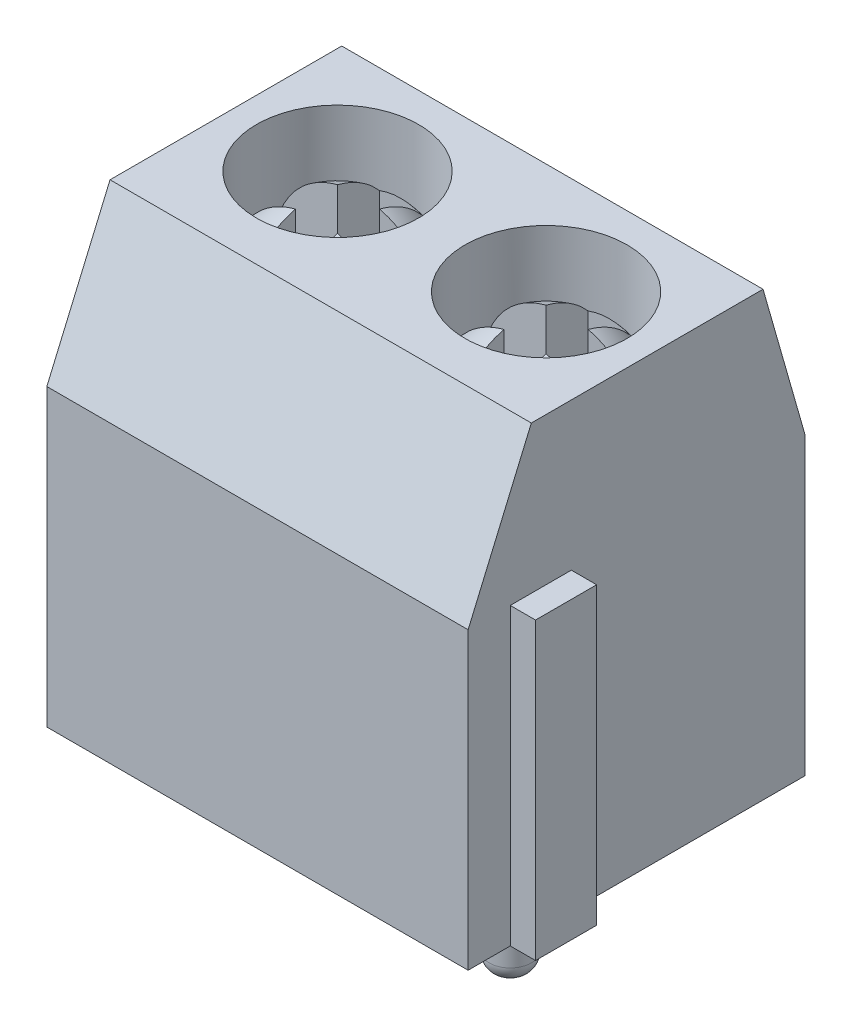
from build123d import *

# Parameters (mm, degrees)
BODY_DEPTH                   = 10
TERMINAL_CUT_OUT_SKETCH_W    = 4
TERMINAL_CUT_OUT_SKETCH_H    = 5
TERMINAL_CUT_OUT_DEPTH       = 2
SKETCH3_W                    = 1
SKETCH3_H                    = 1
CUT_EXTRUDE2_DEPTH           = 5
SKETCH4_R                    = 1.5
CUT_EXTRUDE3_DEPTH           = 5
BOSS_EXTRUDE2_DEPTH          = 0.1
PINS_SKETCH_R                = 0.499
PINS_DEPTH                   = 4
PIN_ENDS_FILLETS_R           = 0.4
LINK_CUT_SKETCH_W            = 1.3
LINK_CUT_SKETCH_H            = 7
LINK_CUT_EXTRUDE_DEPTH       = 0.6
LINK_BOSS_SKETCH_W           = 1.45
LINK_BOSS_SKETCH_H           = 7
LINK_BOSS_EXTRUDE_DEPTH      = 0.6
SCREW_HOLE_SKETCH_R          = 1.925
SCREW_HOLE_CUT_DEPTH         = 2
SKETCH11_W                   = 2
SKETCH11_H                   = 0.1
BOSS_EXTRUDE7_DEPTH          = 3
FILLET1_R                    = 0.1
SKETCH15_W                   = 1
SKETCH15_H                   = 1
CUT_EXTRUDE6_DEPTH           = 3
CUT_EXTRUDE8_DEPTH           = 1
CUT_EXTRUDE8_DRAFT           = -20
CUT_EXTRUDE8_PROFILE_2_DEPTH = 1
CUT_EXTRUDE8_PROFILE_2_DRAFT = -20


with BuildPart() as part:
    # Body Sketch → Body (new body)
    with BuildSketch(Plane(origin=(0, 0, 0), x_dir=(0, 0, -1), z_dir=(1, 0, 0))):
        Polygon((0, 0), (0, 7), (1.5, 10.5), (7, 10.5), (8, 7), (8, 0), align=None)
    extrude(amount=BODY_DEPTH)

    # Terminal Cut Out Sketch → Terminal Cut Out (cut)
    with BuildSketch(Plane(origin=(0, 0, -8), x_dir=(-1, 0, 0), z_dir=(0, 0, -1))):
        with Locations((-7.5, 3.5)):
            Rectangle(TERMINAL_CUT_OUT_SKETCH_W, TERMINAL_CUT_OUT_SKETCH_H)
        with Locations((-2.5, 3.5)):
            Rectangle(TERMINAL_CUT_OUT_SKETCH_W, TERMINAL_CUT_OUT_SKETCH_H)
    extrude(amount=-TERMINAL_CUT_OUT_DEPTH, mode=Mode.SUBTRACT)

    # Sketch3 → Cut-Extrude2 (cut)
    with BuildSketch(Plane(origin=(0, 0, -8), x_dir=(-1, 0, 0), z_dir=(0, 0, -1))):
        with Locations((-7.5, 0.5)):
            Rectangle(SKETCH3_W, SKETCH3_H)
        with Locations((-2.5, 0.5)):
            Rectangle(SKETCH3_W, SKETCH3_H)
    extrude(amount=-CUT_EXTRUDE2_DEPTH, mode=Mode.SUBTRACT)

    # Sketch4 → Cut-Extrude3 (cut)
    with BuildSketch(Plane(origin=(0, 0, -6), x_dir=(-1, 0, 0), z_dir=(0, 0, -1))):
        with Locations(Location((-7.5, 3.5, 0), (0, 0, 90))):
            Circle(SKETCH4_R)
        with Locations(Location((-2.5, 3.5, 0), (0, 0, 90))):
            Circle(SKETCH4_R)
    extrude(amount=-CUT_EXTRUDE3_DEPTH, mode=Mode.SUBTRACT)

    # Sketch6 → Boss-Extrude2 (add)
    with BuildSketch(Plane(origin=(0, 0, -6), x_dir=(-1, 0, 0), z_dir=(0, 0, -1))):
        Polygon((-9.5, 6), (-8.5, 3), (-6.5, 3), (-5.5, 6), align=None)
        Polygon((-4.5, 6), (-0.5, 6), (-1.5, 3), (-3.5, 3), align=None)
    extrude(amount=BOSS_EXTRUDE2_DEPTH)

    # Pins Sketch → Pins (add)
    with BuildSketch(Plane.XZ.offset(-1)):
        with Locations(Location((2.5, -3.5, 0), (0, 0, 90))):
            Circle(PINS_SKETCH_R)
        with Locations(Location((7.5, -3.5, 0), (0, 0, 90))):
            Circle(PINS_SKETCH_R)
    extrude(amount=PINS_DEPTH)

    # Pin Ends Fillets
    pin_ends_fillets_edges = [part.edges().sort_by_distance(p)[0] for p in [
        (2.5, -3, -3.999),
        (7.5, -3, -3.999),
    ]]
    fillet(pin_ends_fillets_edges, radius=PIN_ENDS_FILLETS_R)

    # Link Cut Sketch → Link Cut Extrude (cut)
    with BuildSketch(Plane.ZY):
        with Locations((-1.65, 3.5)):
            Rectangle(LINK_CUT_SKETCH_W, LINK_CUT_SKETCH_H)
    extrude(amount=-LINK_CUT_EXTRUDE_DEPTH, mode=Mode.SUBTRACT)

    # Link Boss Sketch → Link Boss Extrude (add)
    with BuildSketch(Plane(origin=(10, 0, 0), x_dir=(0, 0, -1), z_dir=(1, 0, 0))):
        with Locations((1.725, 3.5)):
            Rectangle(LINK_BOSS_SKETCH_W, LINK_BOSS_SKETCH_H)
    extrude(amount=LINK_BOSS_EXTRUDE_DEPTH)

    # Screw Hole Sketch → Screw Hole Cut (cut)
    with BuildSketch(Plane(origin=(0, 10.5, 0), x_dir=(1, 0, 0), z_dir=(0, 1, 0))):
        with Locations(Location((2.525, 4.375, 0), (0, 0, 270))):
            Circle(SCREW_HOLE_SKETCH_R)
        with Locations(Location((7.475, 4.375, 0), (0, 0, 90))):
            Circle(SCREW_HOLE_SKETCH_R)
    extrude(amount=-SCREW_HOLE_CUT_DEPTH, mode=Mode.SUBTRACT)

    # Sketch11 → Boss-Extrude7 (add)
    with BuildSketch(Plane(origin=(0, 0, -6.1), x_dir=(-1, 0, 0), z_dir=(0, 0, -1))):
        with Locations((-7.5, 2.95)):
            Rectangle(SKETCH11_W, SKETCH11_H)
        with Locations((-2.5, 2.95)):
            Rectangle(SKETCH11_W, SKETCH11_H)
    extrude(amount=-BOSS_EXTRUDE7_DEPTH)

    # Fillet1
    fillet1_edges = [part.edges().sort_by_distance(p)[0] for p in [
        (2.5, 2.9, -6.1),
        (7.5, 2.9, -6.1),
    ]]
    fillet(fillet1_edges, radius=FILLET1_R)

    # Sketch13 → Revolve1 (revolve)
    with BuildSketch(Plane.XY.offset(-4.375)):
        with BuildLine():
            Line((7.475, 9.848322), (7.475, 8.5))
            Line((7.475, 8.5), (9.4, 8.5))
            ThreePointArc((9.4, 8.5), (8.650117, 9.477714), (7.475, 9.848322))
        make_face()
    revolve1 = revolve(axis=Axis((7.475, 8.5, -4.375), (0, 1, 0)))

    # Sketch15 → Cut-Extrude6 (cut)
    with BuildSketch(Plane(origin=(0, 10.5, 0), x_dir=(1, 0, 0), z_dir=(0, 1, 0))):
        with BuildLine():
            Line((9.333931, 4.875), (7.975, 4.875))
            Line((7.975, 4.875), (7.975, 3.875))
            Line((7.975, 3.875), (9.333931, 3.875))
            ThreePointArc((9.333931, 3.875), (9.383411, 4.122827), (9.4, 4.375))
            ThreePointArc((9.4, 4.375), (9.383411, 4.627173), (9.333931, 4.875))
        make_face()
        with Locations((7.475, 4.375)):
            Rectangle(SKETCH15_W, SKETCH15_H)
        with Locations((7.475, 5.375)):
            Rectangle(SKETCH15_W, SKETCH15_H)
        with BuildLine():
            Line((6.975, 3.875), (6.975, 4.875))
            Line((6.975, 4.875), (5.616069, 4.875))
            ThreePointArc((5.616069, 4.875), (5.55, 4.375), (5.616069, 3.875))
            Line((5.616069, 3.875), (6.975, 3.875))
        make_face()
        with Locations((7.475, 3.375)):
            Rectangle(SKETCH15_W, SKETCH15_H)
    cut_extrude6 = extrude(amount=-CUT_EXTRUDE6_DEPTH, mode=Mode.SUBTRACT)

    # Mirror1: Revolve1, Cut-Extrude6 across plane
    add(revolve1.mirror(Plane(origin=(5, 0, 0), x_dir=(0, 0, 1), z_dir=(1, 0, 0))))
    add(cut_extrude6.mirror(Plane(origin=(5, 0, 0), x_dir=(0, 0, 1), z_dir=(1, 0, 0))), mode=Mode.SUBTRACT)


with BuildPart() as cut_extrude8_tool:
    # Sketch17 → Cut-Extrude8 (with draft: the straight prism first)
    with BuildSketch(Plane(origin=(0, 7.5, 0), x_dir=(1, 0, 0), z_dir=(0, 1, 0))):
        with BuildLine():
            Line((2.025, 4.875), (0.666069, 4.875))
            ThreePointArc((0.666069, 4.875), (0.6, 4.375), (0.666069, 3.875))
            Line((0.666069, 3.875), (2.025, 3.875))
            Line((2.025, 3.875), (2.025, 2.875))
            Line((2.025, 2.875), (3.025, 2.875))
            Line((3.025, 2.875), (3.025, 3.875))
            Line((3.025, 3.875), (4.383931, 3.875))
            ThreePointArc((4.383931, 3.875), (4.45, 4.375), (4.383931, 4.875))
            Line((4.383931, 4.875), (3.025, 4.875))
            Line((3.025, 4.875), (3.025, 5.875))
            Line((3.025, 5.875), (2.025, 5.875))
            Line((2.025, 5.875), (2.025, 4.875))
        make_face()
    extrude(amount=-CUT_EXTRUDE8_DEPTH)
    # Cut-Extrude8: the draft: its side faces are tilted about the plane it starts from
    cut_extrude8_sides = [cut_extrude8_tool.faces().sort_by_distance(p)[0] for p in [
        (3.704466, 7, -4.875),
        (3.025, 7, -5.375),
        (2.525, 7, -5.875),
        (2.025, 7, -5.375),
        (1.345534, 7, -4.875),
        (0.6, 7, -4.375),
        (1.345534, 7, -3.875),
        (2.025, 7, -3.375),
        (2.525, 7, -2.875),
        (3.025, 7, -3.375),
        (3.704466, 7, -3.875),
        (4.45, 7, -4.375),
    ]]
    draft(cut_extrude8_sides, Plane(origin=(0, 7.5, 0), x_dir=(1, 0, 0), z_dir=(0, 1, 0)), CUT_EXTRUDE8_DRAFT)


with BuildPart() as part_1:
    add(part.part)

    # Cut-Extrude8: cut by cut_extrude8_tool
    add(cut_extrude8_tool.part, mode=Mode.SUBTRACT)


with BuildPart() as cut_extrude8_profile_2_tool:
    # Sketch17 → Cut-Extrude8 profile 2 (with draft: the straight prism first)
    with BuildSketch(Plane(origin=(0, 7.5, 0), x_dir=(1, 0, 0), z_dir=(0, 1, 0))):
        with BuildLine():
            Line((9.333931, 4.875), (7.975, 4.875))
            Line((7.975, 4.875), (7.975, 5.875))
            Line((7.975, 5.875), (6.975, 5.875))
            Line((6.975, 5.875), (6.975, 4.875))
            Line((6.975, 4.875), (5.616069, 4.875))
            ThreePointArc((5.616069, 4.875), (5.55, 4.375), (5.616069, 3.875))
            Line((5.616069, 3.875), (6.975, 3.875))
            Line((6.975, 3.875), (6.975, 2.875))
            Line((6.975, 2.875), (7.975, 2.875))
            Line((7.975, 2.875), (7.975, 3.875))
            Line((7.975, 3.875), (9.333931, 3.875))
            ThreePointArc((9.333931, 3.875), (9.4, 4.375), (9.333931, 4.875))
        make_face()
    extrude(amount=-CUT_EXTRUDE8_PROFILE_2_DEPTH)
    # Cut-Extrude8 profile 2: the draft: its side faces are tilted about the plane it starts from
    cut_extrude8_profile_2_sides = [cut_extrude8_profile_2_tool.faces().sort_by_distance(p)[0] for p in [
        (6.295534, 7, -3.875),
        (6.975, 7, -3.375),
        (7.475, 7, -2.875),
        (7.975, 7, -3.375),
        (8.654466, 7, -3.875),
        (9.4, 7, -4.375),
        (8.654466, 7, -4.875),
        (7.975, 7, -5.375),
        (7.475, 7, -5.875),
        (6.975, 7, -5.375),
        (6.295534, 7, -4.875),
        (5.55, 7, -4.375),
    ]]
    draft(cut_extrude8_profile_2_sides, Plane(origin=(0, 7.5, 0), x_dir=(1, 0, 0), z_dir=(0, 1, 0)), CUT_EXTRUDE8_PROFILE_2_DRAFT)


with BuildPart() as part_2:
    add(part_1.part)

    # Cut-Extrude8 profile 2: cut by cut_extrude8_profile_2_tool
    add(cut_extrude8_profile_2_tool.part, mode=Mode.SUBTRACT)


solid = part_2.part
